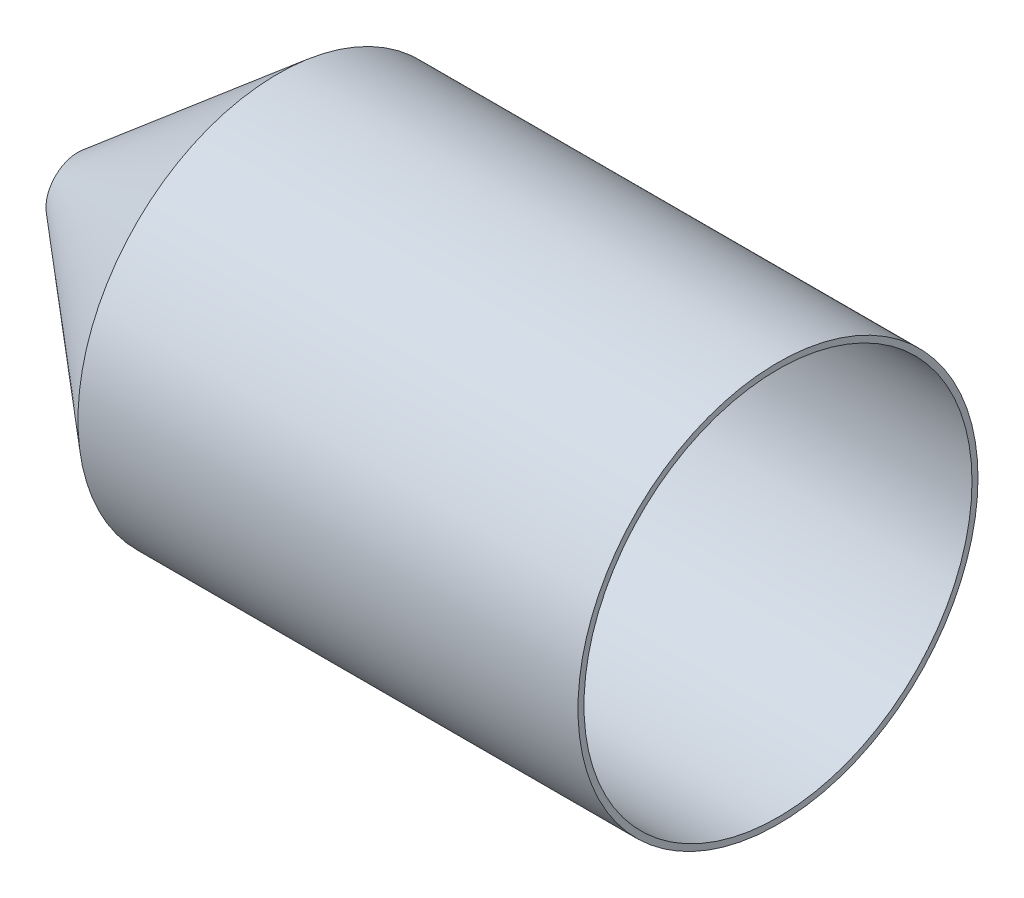
from build123d import *

# Parameters (mm, degrees)
SKETCH1_R           = 100
SKETCH1_R_2         = 97
BOSS_EXTRUDE1_DEPTH = 250


with BuildPart() as part:
    # Sketch1 → Boss-Extrude1 (new body)
    with BuildSketch(Plane(origin=(0, 0, 0), x_dir=(0, 0, -1), z_dir=(1, 0, 0))):
        Circle(SKETCH1_R)
        Circle(SKETCH1_R_2, mode=Mode.SUBTRACT)
    extrude(amount=BOSS_EXTRUDE1_DEPTH)


solid = part.part
